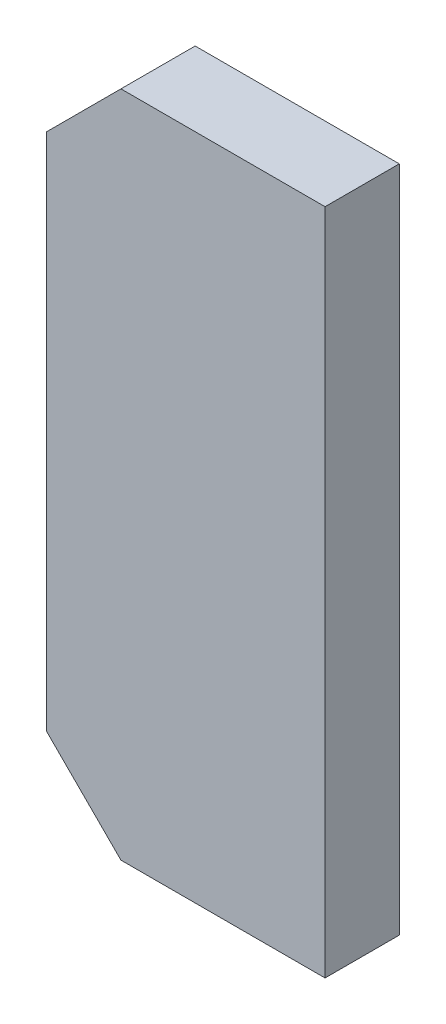
from build123d import *

# Parameters (mm, degrees)
SKETCH1_W           = 47.625
SKETCH1_H           = 114.3
BOSS_EXTRUDE1_DEPTH = 12.7
CHAMFER1_SIZE       = 12.7


with BuildPart() as part:
    # Sketch1 → Boss-Extrude1 (new body)
    with BuildSketch(Plane.XY):
        with Locations((-26.9875, 476.25)):
            Rectangle(SKETCH1_W, SKETCH1_H)
    extrude(amount=BOSS_EXTRUDE1_DEPTH)

    # Chamfer1
    chamfer1_edges = [part.edges().sort_by_distance(p)[0] for p in [
        (-50.8, 533.4, 6.35),
        (-50.8, 419.1, 6.35),
    ]]
    chamfer(chamfer1_edges, length=CHAMFER1_SIZE)


solid = part.part
